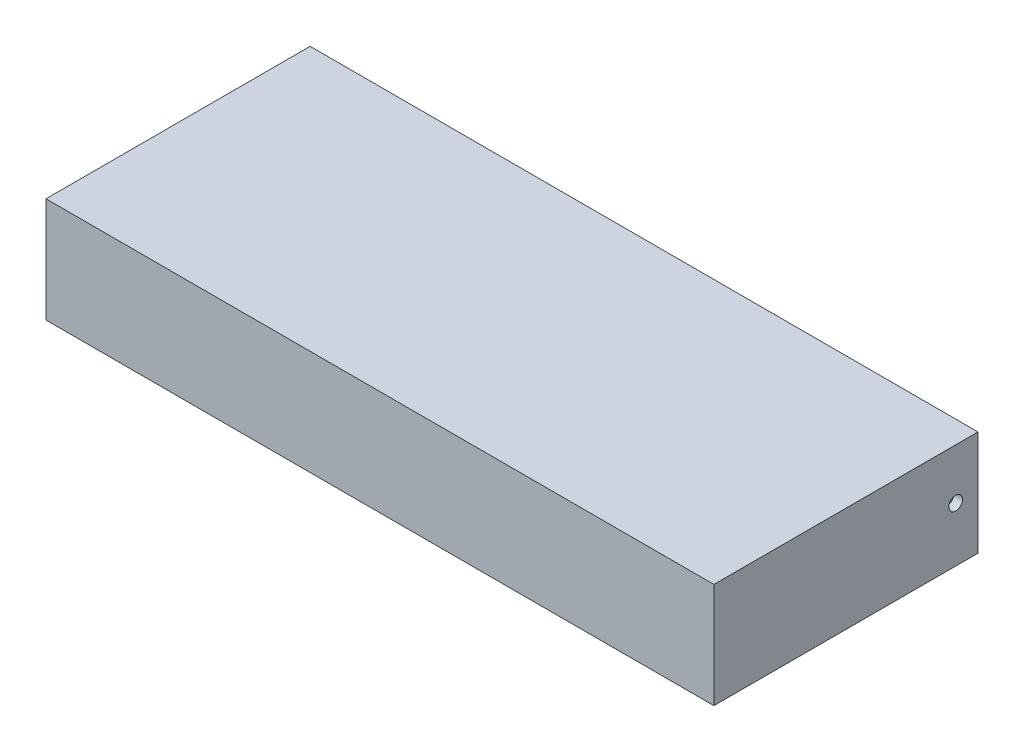
from build123d import *

# Parameters (mm, degrees)
SKETCH_1_W          = 1520
SKETCH_1_H          = 601
EXTRUDE_1_DEPTH     = 239
SKETCH_2_R          = 15.6
CUT_EXTRUDE_1_DEPTH = 20


with BuildPart() as part:
    # 스케치1 → 보스-돌출1 (new body)
    with BuildSketch(Plane(origin=(0, 0, 0), x_dir=(1, 0, 0), z_dir=(0, 1, 0))):
        Rectangle(SKETCH_1_W, SKETCH_1_H)
    extrude(amount=EXTRUDE_1_DEPTH)

    # 스케치2 → 컷-돌출1 (cut)
    with BuildSketch(Plane(origin=(760, 0, 0), x_dir=(0, 0, -1), z_dir=(1, 0, 0))):
        with Locations((249.7, 124)):
            Circle(SKETCH_2_R)
    extrude(amount=-CUT_EXTRUDE_1_DEPTH, mode=Mode.SUBTRACT)


solid = part.part
